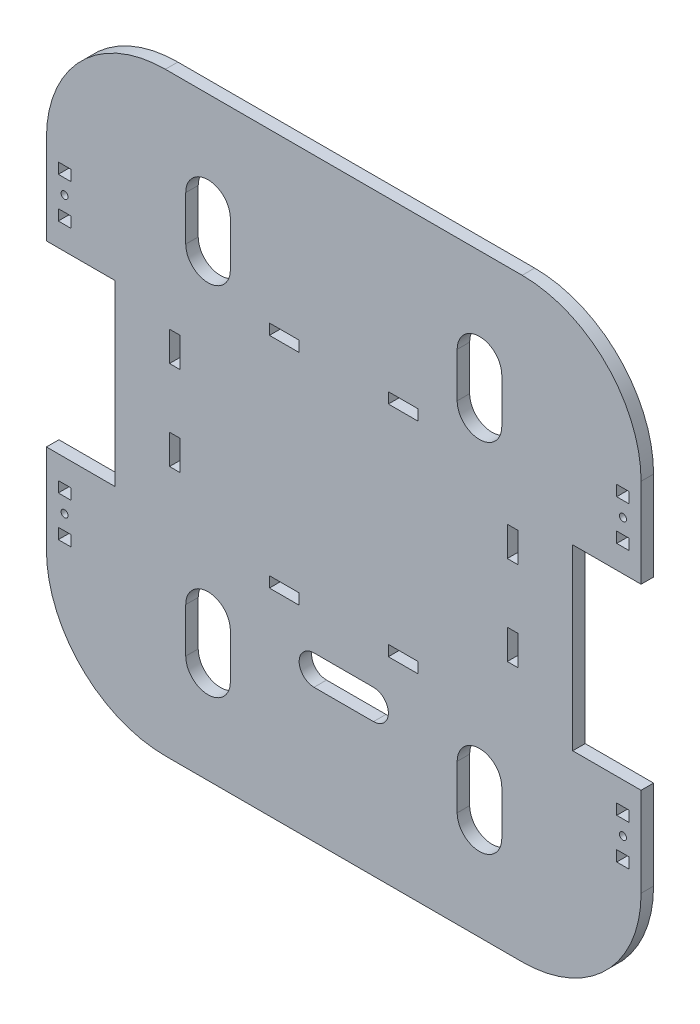
from build123d import *

# Parameters (mm, degrees)
BOSS_EXTRUDE1_DEPTH = 5.334
CUT_EXTRUDE1_DEPTH  = 5.334
SKETCH6_R           = 1.5
SKETCH6_W           = 5.334
SKETCH6_H           = 4.572
CUT_EXTRUDE4_DEPTH  = 360.249845589
CUT_EXTRUDE5_DEPTH  = 360.249845589
CUT_EXTRUDE6_DEPTH  = 7.62
SKETCH11_W          = 12.7
SKETCH11_H          = 4.572
SKETCH11_W_2        = 4.572
SKETCH11_H_2        = 12.7
CUT_EXTRUDE9_DEPTH  = 360.249845589


with BuildPart() as part:
    # Sketch1 → Boss-Extrude1 (new body)
    with BuildSketch(Plane.XY):
        with BuildLine():
            Line((50.8, 0), (203.2, 0))
            ThreePointArc((203.2, 0), (239.121024484, 14.878975516), (254, 50.8))
            Line((254, 50.8), (254, 203.2))
            ThreePointArc((254, 203.2), (239.121024484, 239.121024484), (203.2, 254))
            Line((203.2, 254), (50.8, 254))
            ThreePointArc((50.8, 254), (14.878975516, 239.121024484), (0, 203.2))
            Line((0, 203.2), (0, 50.8))
            ThreePointArc((0, 50.8), (14.878975516, 14.878975516), (50.8, 0))
        make_face()
    extrude(amount=BOSS_EXTRUDE1_DEPTH)

    # Sketch3 → Cut-Extrude1 (cut)
    with BuildSketch(Plane.XY.offset(5.334)):
        Polygon((29.21, 95.25), (29.21, 88.9), (0, 88.9), (0, 165.1), (29.21, 165.1), (29.21, 158.75), (29.21, 146.05), (29.21, 133.35), (29.21, 120.65), (29.21, 107.95), align=None)
        Polygon((254, 165.1), (224.79, 165.1), (224.79, 158.75), (224.79, 146.05), (224.79, 133.35), (224.79, 120.65), (224.79, 107.95), (224.79, 95.25), (224.79, 88.9), (254, 88.9), align=None)
    extrude(amount=-CUT_EXTRUDE1_DEPTH, mode=Mode.SUBTRACT)

    # Sketch6 → Cut-Extrude4 (cut, through all)
    with BuildSketch(Plane.XY.offset(5.334)):
        with Locations((7.747, 185.928)):
            Circle(SKETCH6_R)
        with Locations(Location((246.253, 185.928, 0), (0, 0, 180))):
            Circle(SKETCH6_R)
        with Locations((246.253, 68.072)):
            Circle(SKETCH6_R)
        with Locations(Location((7.747, 68.072, 0), (0, 0, 180))):
            Circle(SKETCH6_R)
        with Locations((7.747, 194.564)):
            Rectangle(SKETCH6_W, SKETCH6_H)
        with Locations((7.747, 177.292)):
            Rectangle(SKETCH6_W, SKETCH6_H)
        with Locations((246.253, 177.292)):
            Rectangle(SKETCH6_W, SKETCH6_H)
        with Locations((246.253, 194.564)):
            Rectangle(SKETCH6_W, SKETCH6_H)
        with Locations((246.253, 59.436)):
            Rectangle(SKETCH6_W, SKETCH6_H)
        with Locations((246.253, 76.708)):
            Rectangle(SKETCH6_W, SKETCH6_H)
        with Locations((7.747, 76.708)):
            Rectangle(SKETCH6_W, SKETCH6_H)
        with Locations((7.747, 59.436)):
            Rectangle(SKETCH6_W, SKETCH6_H)
    extrude(amount=-CUT_EXTRUDE4_DEPTH, mode=Mode.SUBTRACT)

    # Sketch7 → Cut-Extrude5 (cut, through all)
    with BuildSketch(Plane.XY.offset(5.334)):
        with BuildLine():
            Line((78.555827904, 60.325), (78.555827904, 41.275))
            ThreePointArc((78.555827904, 41.275), (69.030827904, 31.75), (59.505827904, 41.275))
            Line((59.505827904, 41.275), (59.505827904, 60.325))
            ThreePointArc((59.505827904, 60.325), (69.030827904, 69.85), (78.555827904, 60.325))
        make_face()
        with BuildLine():
            Line((175.444172096, 60.325), (175.444172096, 41.275))
            ThreePointArc((175.444172096, 41.275), (184.969172096, 31.75), (194.494172096, 41.275))
            Line((194.494172096, 41.275), (194.494172096, 60.325))
            ThreePointArc((194.494172096, 60.325), (184.969172096, 69.85), (175.444172096, 60.325))
        make_face()
        with BuildLine():
            Line((175.444172096, 193.675), (175.444172096, 212.725))
            ThreePointArc((175.444172096, 212.725), (184.969172096, 222.25), (194.494172096, 212.725))
            Line((194.494172096, 212.725), (194.494172096, 193.675))
            ThreePointArc((194.494172096, 193.675), (184.969172096, 184.15), (175.444172096, 193.675))
        make_face()
        with BuildLine():
            Line((78.555827904, 193.675), (78.555827904, 212.725))
            ThreePointArc((78.555827904, 212.725), (69.030827904, 222.25), (59.505827904, 212.725))
            Line((59.505827904, 212.725), (59.505827904, 193.675))
            ThreePointArc((59.505827904, 193.675), (69.030827904, 184.15), (78.555827904, 193.675))
        make_face()
    extrude(amount=-CUT_EXTRUDE5_DEPTH, mode=Mode.SUBTRACT)

    # Sketch8 → Cut-Extrude6 (cut)
    with BuildSketch(Plane.XY.offset(5.334)):
        with BuildLine():
            Line((114.3, 69.85), (139.7, 69.85))
            ThreePointArc((139.7, 69.85), (146.05, 63.5), (139.7, 57.15))
            Line((139.7, 57.15), (114.3, 57.15))
            ThreePointArc((114.3, 57.15), (107.95, 63.5), (114.3, 69.85))
        make_face()
    extrude(amount=-CUT_EXTRUDE6_DEPTH, mode=Mode.SUBTRACT)

    # Sketch11 → Cut-Extrude9 (cut, through all)
    with BuildSketch(Plane.XY.offset(5.334)):
        Polygon((146.05, 182.372), (146.05, 177.8), (158.603579352, 177.8), (158.75, 177.8), (158.75, 182.372), align=None)
        with Locations((101.6, 180.086)):
            Rectangle(SKETCH11_W, SKETCH11_H)
        with Locations((199.136, 152.4)):
            Rectangle(SKETCH11_W_2, SKETCH11_H_2)
        Polygon((196.85, 108.5), (196.85, 107.95), (201.422, 107.95), (201.422, 120.65), (196.85, 120.65), align=None)
        with Locations((152.4, 86.614)):
            Rectangle(SKETCH11_W, SKETCH11_H)
        with Locations((101.6, 86.614)):
            Rectangle(SKETCH11_W, SKETCH11_H)
        with Locations((54.864, 114.3)):
            Rectangle(SKETCH11_W_2, SKETCH11_H_2)
        with Locations((54.864, 152.4)):
            Rectangle(SKETCH11_W_2, SKETCH11_H_2)
    extrude(amount=-CUT_EXTRUDE9_DEPTH, mode=Mode.SUBTRACT)


solid = part.part
